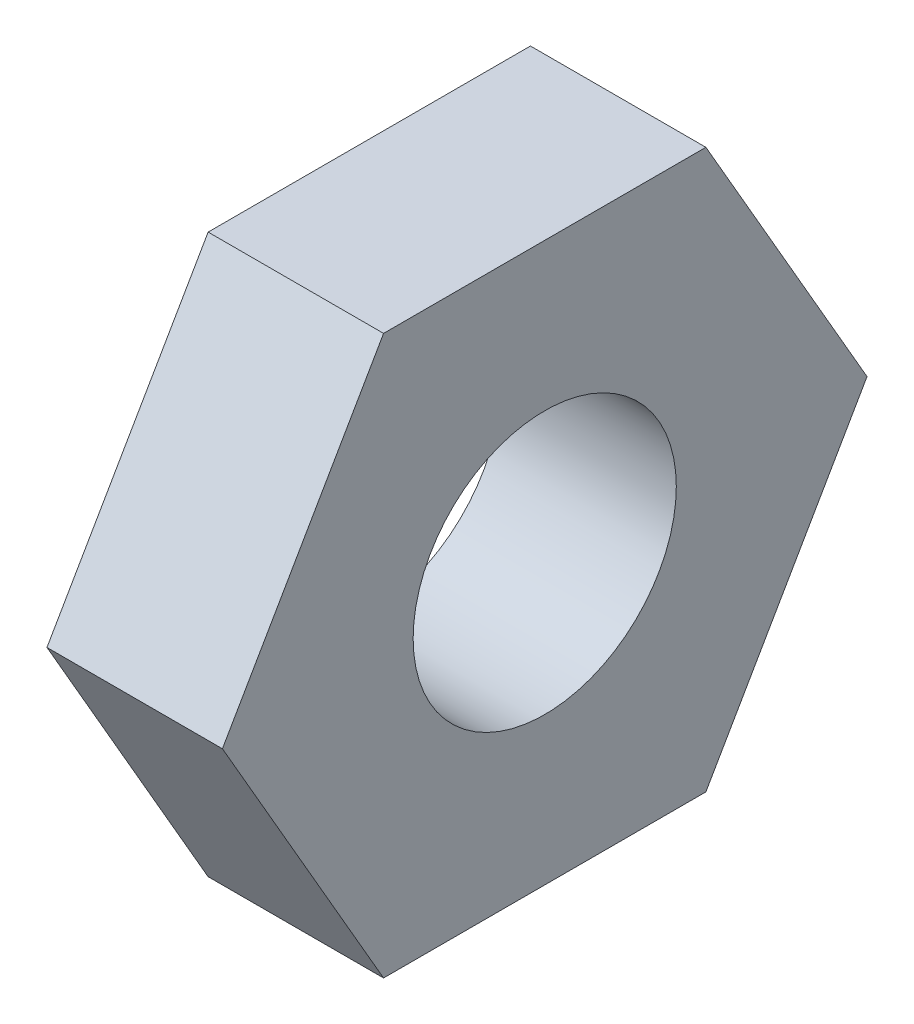
from build123d import *

# Parameters (mm, degrees)
BASENUTSKETCH_R = 1.65
BASENUT_DEPTH   = 2.2


with BuildPart() as part:
    # BaseNutSketch → BaseNut (new body)
    with BuildSketch(Plane(origin=(0, 0, 0), x_dir=(0, 0, -1), z_dir=(1, 0, 0))):
        Polygon((2.020725942, 3.5), (-2.020725942, 3.5), (-4.041451884, 0), (-2.020725942, -3.5), (2.020725942, -3.5), (4.041451884, 0), align=None)
        Circle(BASENUTSKETCH_R, mode=Mode.SUBTRACT)
    extrude(amount=BASENUT_DEPTH)


solid = part.part
